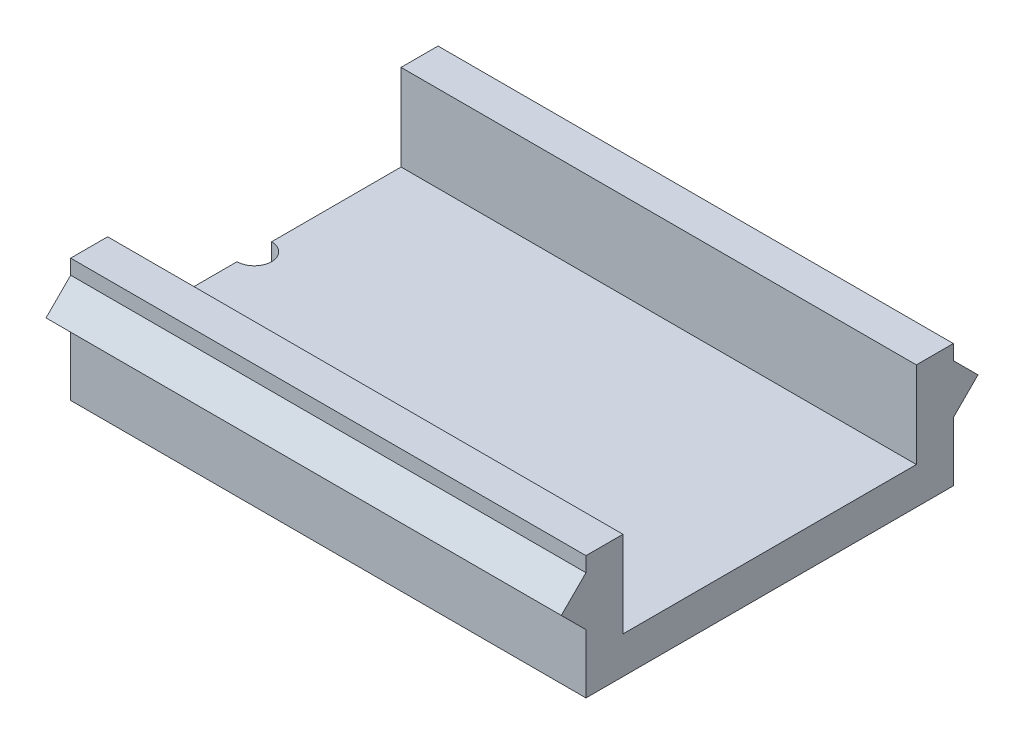
from build123d import *

# Parameters (mm, degrees)
BOSS_EXTRUDE1_DEPTH = 3
BOSS_EXTRUDE2_DEPTH = 41.8
SKETCH5_R           = 2.6
CUT_EXTRUDE1_DEPTH  = 0.6


with BuildPart() as part:
    # Sketch2 → Boss-Extrude1 (new body)
    with BuildSketch(Plane(origin=(0, 0, 0), x_dir=(1, 0, 0), z_dir=(0, 1, 0))):
        with BuildLine():
            Line((-20.9, 1.4), (-20.9, 14.9))
            Line((-20.9, 14.9), (20.9, 14.9))
            Line((20.9, 14.9), (20.9, -14.9))
            Line((20.9, -14.9), (-20.9, -14.9))
            Line((-20.9, -14.9), (-20.9, -1.4))
            ThreePointArc((-20.9, -1.4), (-19.5, 0), (-20.9, 1.4))
        make_face()
    extrude(amount=BOSS_EXTRUDE1_DEPTH)

    # Sketch4 → Boss-Extrude2 (add)
    with BuildSketch(Plane.ZY.offset(20.9)):
        Polygon((-14.9, 3), (-14.9, 4.8), (-16.9, 6.8), (-14.9, 8.8), (-14.9, 10), (-11.9, 10), (-11.9, 3), align=None)
        Polygon((14.9, 3), (11.9, 3), (11.9, 10), (14.9, 10), (14.9, 8.8), (16.9, 6.8), (14.9, 4.8), align=None)
    extrude(amount=-BOSS_EXTRUDE2_DEPTH)

    # Sketch5 → Cut-Extrude1 (cut)
    with BuildSketch(Plane.XZ):
        with Locations(Location((0, 0, 0), (0, 0, 270))):
            Circle(SKETCH5_R)
    extrude(amount=-CUT_EXTRUDE1_DEPTH, mode=Mode.SUBTRACT)


solid = part.part
